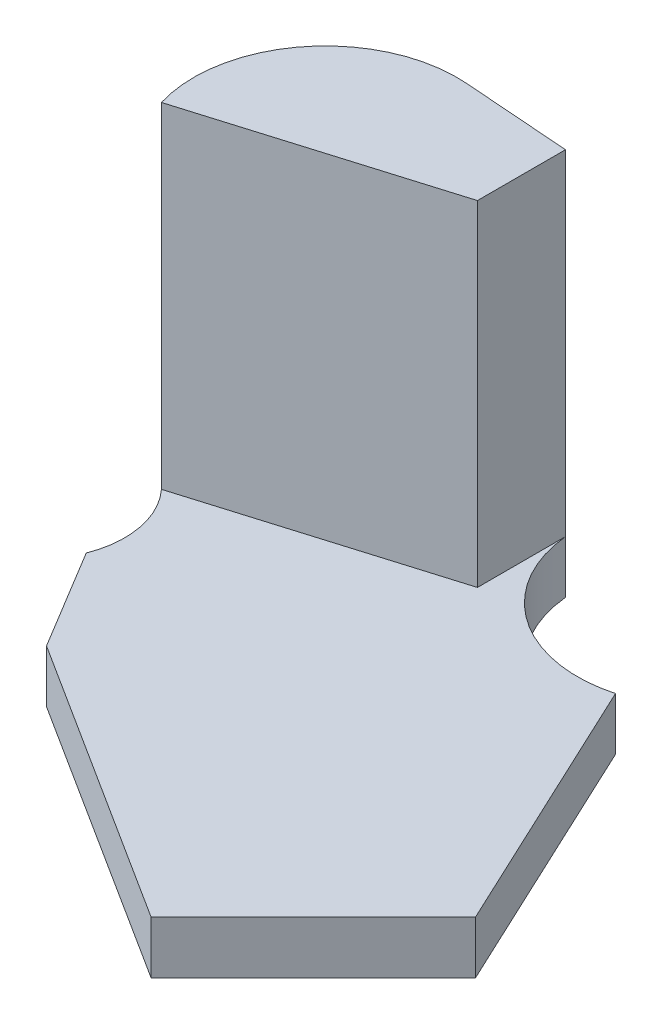
from build123d import *

# Parameters (mm, degrees)
BOSS_EXTRUDE1_DEPTH = 48.51400078
BOSS_EXTRUDE2_DEPTH = 7.62


with BuildPart() as part:
    # Sketch2 → Boss-Extrude1 (new body)
    with BuildSketch(Plane.XZ.offset(35.996799282)):
        with BuildLine():
            Line((-512.958981795, 54.074719549), (-477.784341144, 43.499133869))
            Line((-477.784341144, 43.499133869), (-477.784341144, 30.750375257))
            Line((-477.784341144, 30.750375257), (-493.297876549, 29.59254273))
            ThreePointArc((-493.297876549, 29.59254273), (-509.568926068, 36.66140776), (-512.958981795, 54.074719549))
        make_face()
    extrude(amount=BOSS_EXTRUDE1_DEPTH)

    # Sketch3 → Boss-Extrude2 (add)
    with BuildSketch(Plane.XZ.offset(84.510800062)):
        with BuildLine():
            Line((-460.055260418, 108.470724329), (-436.590512312, 84.974770196))
            Line((-436.590512312, 84.974770196), (-454.490518063, 46.803141976))
            ThreePointArc((-454.490518063, 46.803141976), (-469.864935435, 44.185661822), (-477.784341144, 30.750375257))
            Line((-477.784341144, 30.750375257), (-493.297876549, 29.59254273))
            ThreePointArc((-493.297876549, 29.59254273), (-509.568926068, 36.66140776), (-512.958981795, 54.074719549))
            ThreePointArc((-512.958981795, 54.074719549), (-509.76637554, 60.425881739), (-510.419261273, 67.504280999))
            Line((-510.419261273, 67.504280999), (-501.653310229, 82.024875489))
            Line((-501.653310229, 82.024875489), (-460.055260418, 108.470724329))
        make_face()
    extrude(amount=BOSS_EXTRUDE2_DEPTH)


solid = part.part
